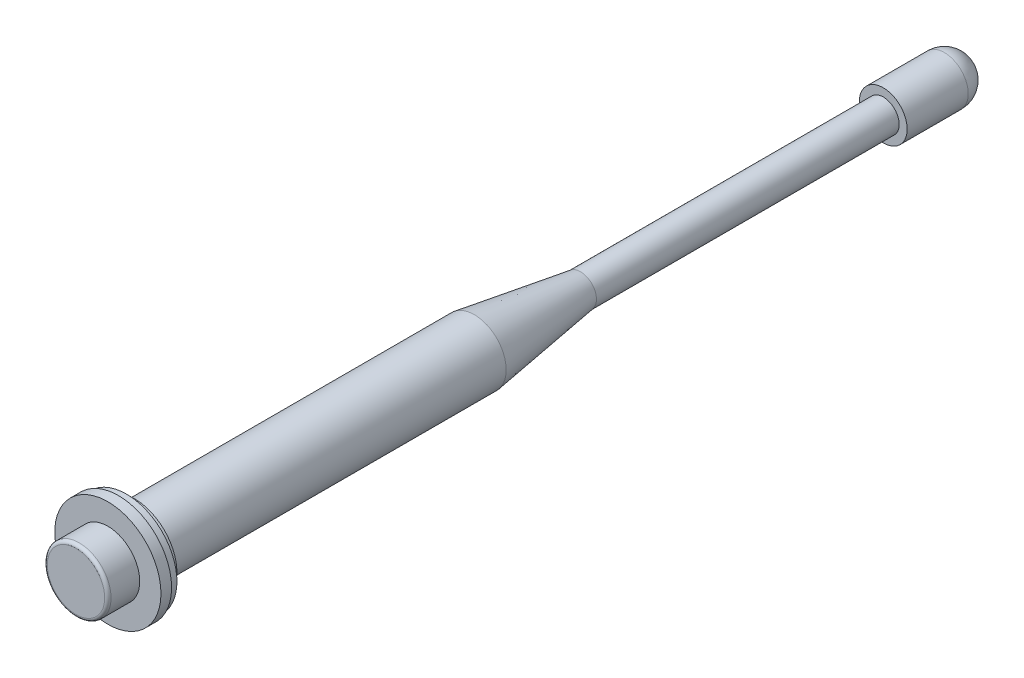
from build123d import *

# Parameters (mm, degrees)
SKETCH1_W           = 28.5
SKETCH1_H           = 1.5
SKETCH1_W_2         = 4
SKETCH1_H_2         = 1.25
FILLET1_R           = 0.3
THREAD1_PITCH       = 0.45
THREAD1_HEIGHT      = 3
THREAD1_RADIUS      = 1.25
SKETCH4_R           = 5
BOSS_EXTRUDE1_DEPTH = 1
SKETCH6_R           = 4.75
BOSS_EXTRUDE3_DEPTH = 0.75
SKETCH7_R           = 4
BOSS_EXTRUDE4_DEPTH = 0.75
CUT_EXTRUDE2_START  = -6.75
SKETCH8_R           = 3
CUT_EXTRUDE2_DEPTH  = 6.75


with BuildPart() as part:
    # Sketch1 → Revolve1 (revolve)
    with BuildSketch(Plane(origin=(0, 0, 0), x_dir=(0, 0, -1), z_dir=(1, 0, 0)), mode=Mode.PRIVATE) as revolve1_sk:
        with Locations((14.25, 0.75)):
            Rectangle(SKETCH1_W, SKETCH1_H)
        Polygon((-47.5, 3), (-47.5, 0), (0, 0), (0, 1.5), (-10, 3), align=None)
        with Locations((30.5, 0.625)):
            Rectangle(SKETCH1_W_2, SKETCH1_H_2)
    revolve(revolve1_sk.sketch.rotate(Axis((0, 0, -28.5), (0, 0, 1)), 90), axis=Axis((0, 0, -28.5), (0, 0, 1)))

    # Fillet1
    fillet1_edges = [part.edges().sort_by_distance(p)[0] for p in [
        (3, 0, 47.5),
    ]]
    fillet(fillet1_edges, radius=FILLET1_R)

    # Thread1: sweep along a helix
    with BuildLine() as thread1_path:
        Helix(THREAD1_PITCH, THREAD1_HEIGHT, THREAD1_RADIUS, center=(0, 0, -32.5), direction=(0, 0, 1))
    # Thread Profile1 → Thread1 (sweep)
    with BuildSketch(Plane(origin=(1.25, 0, -32.5), x_dir=(1, 0, 0), z_dir=(0, -1, 0))):
        Polygon((0, 0), (0.243569644, 0.140624999), (0.243569644, 0.196874999), (0, 0.337499999), align=None)
    sweep(path=thread1_path.line, is_frenet=True)


with BuildPart() as body_2:
    # Sketch4 → Boss-Extrude1 (new body)
    with BuildSketch(Plane.XY.offset(44.5)):
        Circle(SKETCH4_R)
    extrude(amount=-BOSS_EXTRUDE1_DEPTH)


with BuildPart() as body_3:
    # Sketch6 → Boss-Extrude3 (new body)
    with BuildSketch(Plane(origin=(0, 0, 43.5), x_dir=(-1, 0, 0), z_dir=(0, 0, -1))):
        Circle(SKETCH6_R)
    extrude(amount=BOSS_EXTRUDE3_DEPTH)

    # Sketch7 → Boss-Extrude4 (add)
    with BuildSketch(Plane(origin=(0, 0, 42.75), x_dir=(-1, 0, 0), z_dir=(0, 0, -1))):
        Circle(SKETCH7_R)
    extrude(amount=BOSS_EXTRUDE4_DEPTH)


with BuildPart() as cut_extrude2_tool:
    # Sketch8 → Cut-Extrude2 (new body)
    with BuildSketch(Plane(origin=(0, 0, 42), x_dir=(-1, 0, 0), z_dir=(0, 0, -1)).offset(CUT_EXTRUDE2_START)):
        Circle(SKETCH8_R)
    extrude(amount=CUT_EXTRUDE2_DEPTH)


with BuildPart() as body_3_1:
    add(body_3.part)

    # Cut-Extrude2: cut by cut_extrude2_tool
    add(cut_extrude2_tool.part, mode=Mode.SUBTRACT)


with BuildPart() as body_2_1:
    add(body_2.part)

    # Cut-Extrude2: cut by cut_extrude2_tool
    add(cut_extrude2_tool.part, mode=Mode.SUBTRACT)


with BuildPart() as body_4:
    # Sketch1<3> → Revolve2 (revolve)
    with BuildSketch(Plane(origin=(0, 0, 0), x_dir=(0, 0, -1), z_dir=(1, 0, 0)), mode=Mode.PRIVATE) as revolve2_sk:
        with BuildLine():
            Line((28.5, 2.25), (28.5, 1.5))
            Line((28.5, 1.5), (28.5, 1.25))
            Line((28.5, 1.25), (32.5, 1.25))
            Line((32.5, 1.25), (32.5, 0))
            Line((32.5, 0), (36.5, 0))
            ThreePointArc((36.5, 0), (35.840990258, 1.590990258), (34.25, 2.25))
            Line((34.25, 2.25), (28.5, 2.25))
        make_face()
    revolve(revolve2_sk.sketch.rotate(Axis((0, 0, -28.5), (0, 0, 1)), 90), axis=Axis((0, 0, -28.5), (0, 0, 1)))


solid = Compound([part.part, body_3_1.part, body_2_1.part, body_4.part])
